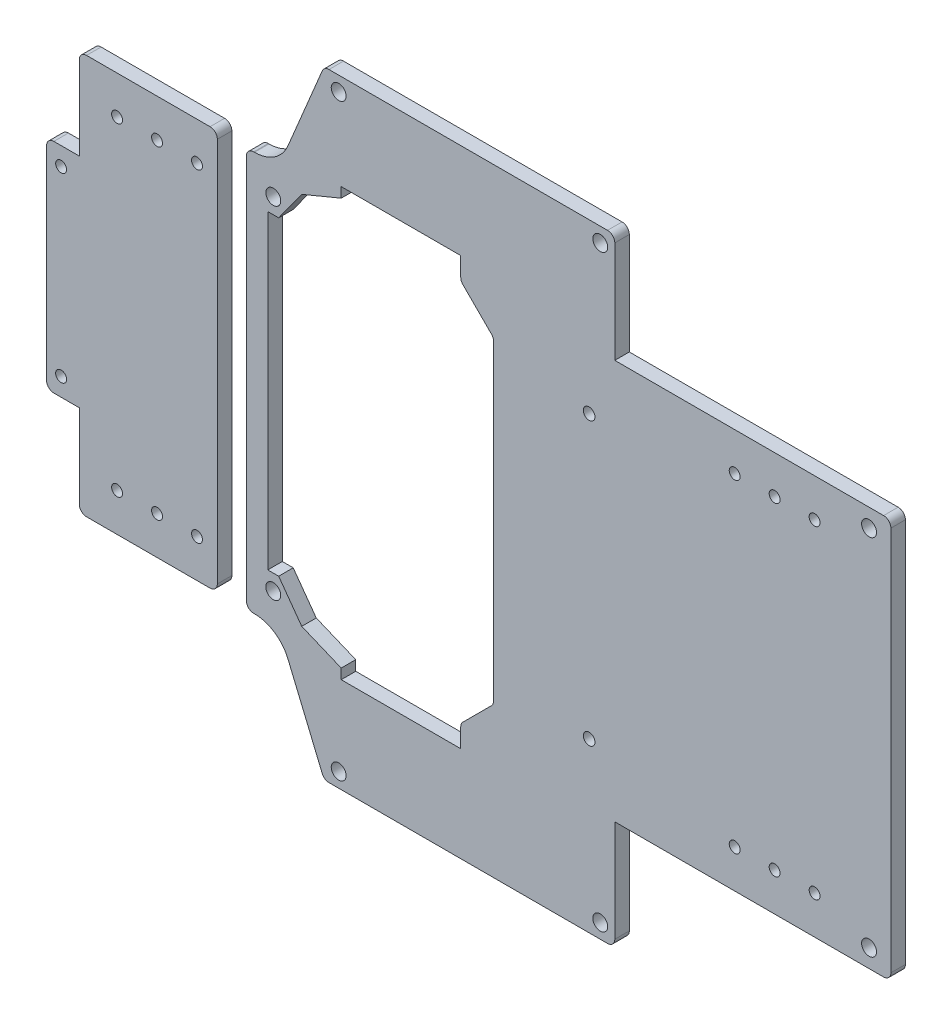
from build123d import *

# Parameters (mm, degrees)
EXTRUDE_1_DEPTH     = 4
EXTRUDE_1_2_DEPTH   = 4
SKETCH_2_W          = 53.11733904
SKETCH_2_H          = 4.531112107
CUT_EXTRUDE_1_DEPTH = 4
CUT_EXTRUDE_2_DEPTH = 4
FILLET_1_R          = 2


with BuildPart() as part:
    # 草图1 → 凸台-拉伸1 (new body)
    with BuildSketch(Plane.XY):
        with BuildLine():
            Line((-97.250083826, -29.854708147), (-104.250083826, -29.854708147))
            ThreePointArc((-104.250083826, -29.854708147), (-105.664297388, -30.440494585), (-106.250083826, -31.854708147))
            Line((-106.250083826, -31.854708147), (-106.250083826, -87.854708147))
            ThreePointArc((-106.250083826, -87.854708147), (-105.664297388, -89.26892171), (-104.250083826, -89.854708147))
            Line((-104.250083826, -89.854708147), (-97.250083826, -89.854708147))
            Line((-97.250083826, -89.854708147), (-97.250083826, -112.854708147))
            ThreePointArc((-97.250083826, -112.854708147), (-96.664297388, -114.26892171), (-95.250083826, -114.854708147))
            Line((-95.250083826, -114.854708147), (-61.250083826, -114.854708147))
            ThreePointArc((-61.250083826, -114.854708147), (-59.835870263, -114.26892171), (-59.250083826, -112.854708147))
            Line((-59.250083826, -112.854708147), (-59.250083826, -6.854708147))
            ThreePointArc((-59.250083826, -6.854708147), (-59.835870263, -5.440494585), (-61.250083826, -4.854708147))
            Line((-61.250083826, -4.854708147), (-95.250083826, -4.854708147))
            ThreePointArc((-95.250083826, -4.854708147), (-96.664297388, -5.440494585), (-97.250083826, -6.854708147))
            Line((-97.250083826, -6.854708147), (-97.250083826, -29.854708147))
        make_face()
        with BuildLine():
            ThreePointArc((-64.846206897, -16.854708147), (-63.346206897, -15.354708147), (-64.846206897, -13.854708147))
            ThreePointArc((-64.846206897, -13.854708147), (-66.346206897, -15.354708147), (-64.846206897, -16.854708147))
        make_face(mode=Mode.SUBTRACT)
        with BuildLine():
            ThreePointArc((-75.846206897, -16.854708147), (-74.346206897, -15.354708147), (-75.846206897, -13.854708147))
            ThreePointArc((-75.846206897, -13.854708147), (-77.346206897, -15.354708147), (-75.846206897, -16.854708147))
        make_face(mode=Mode.SUBTRACT)
        with BuildLine():
            ThreePointArc((-102.250083826, -36.354708147), (-100.750083826, -34.854708147), (-102.250083826, -33.354708147))
            ThreePointArc((-102.250083826, -33.354708147), (-103.750083826, -34.854708147), (-102.250083826, -36.354708147))
        make_face(mode=Mode.SUBTRACT)
        with BuildLine():
            ThreePointArc((-75.846206897, -105.854708147), (-74.346206897, -104.354708147), (-75.846206897, -102.854708147))
            ThreePointArc((-75.846206897, -102.854708147), (-77.346206897, -104.354708147), (-75.846206897, -105.854708147))
        make_face(mode=Mode.SUBTRACT)
        with BuildLine():
            ThreePointArc((-102.250083826, -86.354708147), (-100.750083826, -84.854708147), (-102.250083826, -83.354708147))
            ThreePointArc((-102.250083826, -83.354708147), (-103.750083826, -84.854708147), (-102.250083826, -86.354708147))
        make_face(mode=Mode.SUBTRACT)
        with BuildLine():
            ThreePointArc((-64.846206897, -105.854708147), (-63.346206897, -104.354708147), (-64.846206897, -102.854708147))
            ThreePointArc((-64.846206897, -102.854708147), (-66.346206897, -104.354708147), (-64.846206897, -105.854708147))
        make_face(mode=Mode.SUBTRACT)
        with BuildLine():
            ThreePointArc((-86.846206897, -105.854708147), (-85.346206897, -104.354708147), (-86.846206897, -102.854708147))
            ThreePointArc((-86.846206897, -102.854708147), (-88.346206897, -104.354708147), (-86.846206897, -105.854708147))
        make_face(mode=Mode.SUBTRACT)
        with BuildLine():
            ThreePointArc((-86.846206897, -16.854708147), (-85.346206897, -15.354708147), (-86.846206897, -13.854708147))
            ThreePointArc((-86.846206897, -13.854708147), (-88.346206897, -15.354708147), (-86.846206897, -16.854708147))
        make_face(mode=Mode.SUBTRACT)
    extrude(amount=-EXTRUDE_1_DEPTH)


with BuildPart() as body_2:
    # 草图1 → Extrude 1 2 (new body)
    with BuildSketch(Plane.XY):
        with BuildLine():
            Line((-51.250083826, -6.854708147), (-51.250083826, -112.854708147))
            ThreePointArc((-51.250083826, -112.854708147), (-50.664297388, -114.26892171), (-49.250083826, -114.854708147))
            Line((-49.250083826, -114.854708147), (-49.039806392, -114.854708147))
            ThreePointArc((-49.039806392, -114.854708147), (-43.496806397, -116.531538615), (-39.812740657, -120.999677936))
            Line((-39.812740657, -120.999677936), (-30.35967553, -143.62571419))
            ThreePointArc((-30.35967553, -143.62571419), (-29.622862382, -144.519342054), (-28.514262383, -144.854708147))
            Line((-28.514262383, -144.854708147), (48.153793103, -144.854708147))
            ThreePointArc((48.153793103, -144.854708147), (49.568006666, -144.26892171), (50.153793103, -142.854708147))
            Line((50.153793103, -142.854708147), (50.153793103, -114.854708147))
            Line((50.153793103, -114.854708147), (124.153793103, -114.854708147))
            ThreePointArc((124.153793103, -114.854708147), (125.568006666, -114.26892171), (126.153793103, -112.854708147))
            Line((126.153793103, -112.854708147), (126.153793103, -6.854708147))
            ThreePointArc((126.153793103, -6.854708147), (125.568006666, -5.440494585), (124.153793103, -4.854708147))
            Line((124.153793103, -4.854708147), (50.153793103, -4.854708147))
            Line((50.153793103, -4.854708147), (50.153793103, 23.145291853))
            ThreePointArc((50.153793103, 23.145291853), (49.568006666, 24.559505415), (48.153793103, 25.145291853))
            Line((48.153793103, 25.145291853), (-28.514262383, 25.145291853))
            ThreePointArc((-28.514262383, 25.145291853), (-29.622862382, 24.809925759), (-30.35967553, 23.916297895))
            Line((-30.35967553, 23.916297895), (-39.812740657, 1.290261641))
            ThreePointArc((-39.812740657, 1.290261641), (-43.496806397, -3.177877679), (-49.039806392, -4.854708147))
            Line((-49.039806392, -4.854708147), (-49.250083826, -4.854708147))
            ThreePointArc((-49.250083826, -4.854708147), (-50.664297388, -5.440494585), (-51.250083826, -6.854708147))
        make_face()
        Polygon((-45.365975995, -102.56493354), (-42.365975995, -102.56493354), (-36.021580355, -111.346678778), (-25.151520982, -115.854708147), (2.153793103, -115.854708147), (7.751363045, -111.346678778), (7.751363045, -61.468213714), (-45.365975995, -61.468213714), align=None, mode=Mode.SUBTRACT)
        Polygon((2.153793103, -3.854708147), (-25.151520982, -3.854708147), (-36.021580355, -8.362737517), (-42.365975995, -17.144482755), (-45.365975995, -17.144482755), (-45.365975995, -58.241202581), (7.751363045, -58.241202581), (7.751363045, -8.362737517), align=None, mode=Mode.SUBTRACT)
        with BuildLine():
            ThreePointArc((105.153793103, -105.854708147), (106.653793103, -104.354708147), (105.153793103, -102.854708147))
            ThreePointArc((105.153793103, -102.854708147), (103.653793103, -104.354708147), (105.153793103, -105.854708147))
        make_face(mode=Mode.SUBTRACT)
        with BuildLine():
            ThreePointArc((94.153793103, -16.854708147), (95.653793103, -15.354708147), (94.153793103, -13.854708147))
            ThreePointArc((94.153793103, -13.854708147), (92.653793103, -15.354708147), (94.153793103, -16.854708147))
        make_face(mode=Mode.SUBTRACT)
        with BuildLine():
            ThreePointArc((-25.846206897, -142.904708147), (-23.796206897, -140.854708147), (-25.846206897, -138.804708147))
            ThreePointArc((-25.846206897, -138.804708147), (-27.896206897, -140.854708147), (-25.846206897, -142.904708147))
        make_face(mode=Mode.SUBTRACT)
        with BuildLine():
            ThreePointArc((-43.846206897, -14.904708147), (-41.796206897, -12.854708147), (-43.846206897, -10.804708147))
            ThreePointArc((-43.846206897, -10.804708147), (-45.896206897, -12.854708147), (-43.846206897, -14.904708147))
        make_face(mode=Mode.SUBTRACT)
        with BuildLine():
            ThreePointArc((46.153793103, 19.095291853), (48.203793103, 21.145291853), (46.153793103, 23.195291853))
            ThreePointArc((46.153793103, 23.195291853), (44.103793103, 21.145291853), (46.153793103, 19.095291853))
        make_face(mode=Mode.SUBTRACT)
        with BuildLine():
            ThreePointArc((120.153793103, -11.914708147), (122.213793103, -9.854708147), (120.153793103, -7.794708147))
            ThreePointArc((120.153793103, -7.794708147), (118.093793103, -9.854708147), (120.153793103, -11.914708147))
        make_face(mode=Mode.SUBTRACT)
        with BuildLine():
            ThreePointArc((83.153793103, -16.854708147), (84.653793103, -15.354708147), (83.153793103, -13.854708147))
            ThreePointArc((83.153793103, -13.854708147), (81.653793103, -15.354708147), (83.153793103, -16.854708147))
        make_face(mode=Mode.SUBTRACT)
        with BuildLine():
            ThreePointArc((105.153793103, -16.854708147), (106.653793103, -15.354708147), (105.153793103, -13.854708147))
            ThreePointArc((105.153793103, -13.854708147), (103.653793103, -15.354708147), (105.153793103, -16.854708147))
        make_face(mode=Mode.SUBTRACT)
        with BuildLine():
            ThreePointArc((83.153793103, -105.854708147), (84.653793103, -104.354708147), (83.153793103, -102.854708147))
            ThreePointArc((83.153793103, -102.854708147), (81.653793103, -104.354708147), (83.153793103, -105.854708147))
        make_face(mode=Mode.SUBTRACT)
        with BuildLine():
            ThreePointArc((94.153793103, -105.854708147), (95.653793103, -104.354708147), (94.153793103, -102.854708147))
            ThreePointArc((94.153793103, -102.854708147), (92.653793103, -104.354708147), (94.153793103, -105.854708147))
        make_face(mode=Mode.SUBTRACT)
        with BuildLine():
            ThreePointArc((120.153793103, -111.914708147), (122.213793103, -109.854708147), (120.153793103, -107.794708147))
            ThreePointArc((120.153793103, -107.794708147), (118.093793103, -109.854708147), (120.153793103, -111.914708147))
        make_face(mode=Mode.SUBTRACT)
        with BuildLine():
            ThreePointArc((-25.846206897, 19.095291853), (-23.796206897, 21.145291853), (-25.846206897, 23.195291853))
            ThreePointArc((-25.846206897, 23.195291853), (-27.896206897, 21.145291853), (-25.846206897, 19.095291853))
        make_face(mode=Mode.SUBTRACT)
        with BuildLine():
            ThreePointArc((-43.846206897, -108.904708147), (-41.796206897, -106.854708147), (-43.846206897, -104.804708147))
            ThreePointArc((-43.846206897, -104.804708147), (-45.896206897, -106.854708147), (-43.846206897, -108.904708147))
        make_face(mode=Mode.SUBTRACT)
        with BuildLine():
            ThreePointArc((46.153793103, -142.904708147), (48.203793103, -140.854708147), (46.153793103, -138.804708147))
            ThreePointArc((46.153793103, -138.804708147), (44.103793103, -140.854708147), (46.153793103, -142.904708147))
        make_face(mode=Mode.SUBTRACT)
        with BuildLine():
            ThreePointArc((43.092452976, -97.02026908), (41.492452976, -98.62026908), (43.092452976, -100.22026908))
            ThreePointArc((43.092452976, -100.22026908), (44.692452976, -98.62026908), (43.092452976, -97.02026908))
        make_face(mode=Mode.SUBTRACT)
        with BuildLine():
            ThreePointArc((43.092452976, -19.489147215), (41.492452976, -21.089147215), (43.092452976, -22.689147215))
            ThreePointArc((43.092452976, -22.689147215), (44.692452976, -21.089147215), (43.092452976, -19.489147215))
        make_face(mode=Mode.SUBTRACT)
    extrude(amount=-EXTRUDE_1_2_DEPTH)

    # 草图2 → 切除-拉伸1 (cut)
    with BuildSketch(Plane.XY):
        with Locations((-18.807306475, -59.202657661)):
            Rectangle(SKETCH_2_W, SKETCH_2_H)
        Polygon((7.751363045, -111.346678778), (7.751363045, -118.629885226), (-25.151520982, -118.629885226), (-25.151520982, -115.854708147), align=None)
        Polygon((7.751363045, -8.362737517), (-25.151520982, -3.854708147), (-25.151520982, -1.079531069), (7.751363045, -1.079531069), align=None)
    extrude(amount=-CUT_EXTRUDE_1_DEPTH, mode=Mode.SUBTRACT)

    # 草图3 → 切除-拉伸2 (cut)
    with BuildSketch(Plane.XY):
        Polygon((7.751363045, -112.597547132), (16.776637483, -103.572272693), (16.776637483, -16.137143601), (7.751363045, -7.111869163), align=None)
    extrude(amount=-CUT_EXTRUDE_2_DEPTH, mode=Mode.SUBTRACT)

    # 圆角1
    fillet_1_edges = [body_2.edges().sort_by_distance(p)[0] for p in [
        (7.751363045, -112.597547132, -2),
        (7.751363045, -7.111869163, -2),
        (16.776637483, -16.137143601, -2),
        (16.776637483, -103.572272693, -2),
    ]]
    fillet(fillet_1_edges, radius=FILLET_1_R)


solid = Compound([part.part, body_2.part])
